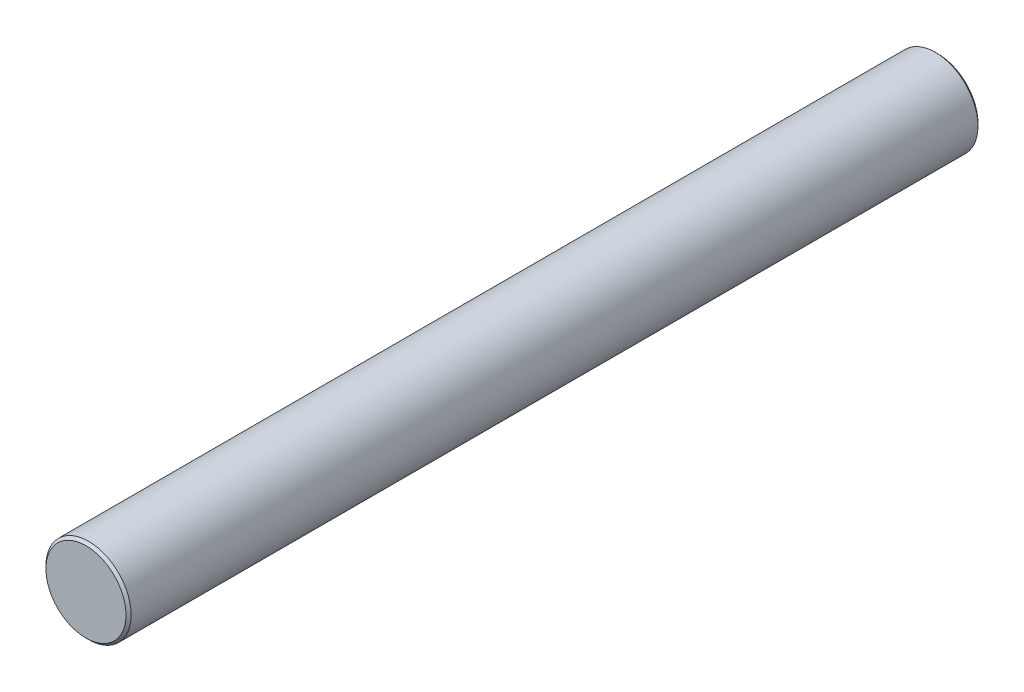
from build123d import *

# Parameters (mm, degrees)
SKETCH1_R           = 5
BOSS_EXTRUDE1_DEPTH = 50
CHAMFER1_SIZE       = 0.3


with BuildPart() as part:
    # Sketch1 → Boss-Extrude1 (new, symmetric)
    with BuildSketch(Plane.XY):
        Circle(SKETCH1_R)
    extrude(amount=BOSS_EXTRUDE1_DEPTH, both=True)

    # Chamfer1
    chamfer1_edges = [part.edges().sort_by_distance(p)[0] for p in [
        (-5, 0, -50),
        (-5, 0, 50),
    ]]
    chamfer(chamfer1_edges, length=CHAMFER1_SIZE)


solid = part.part
